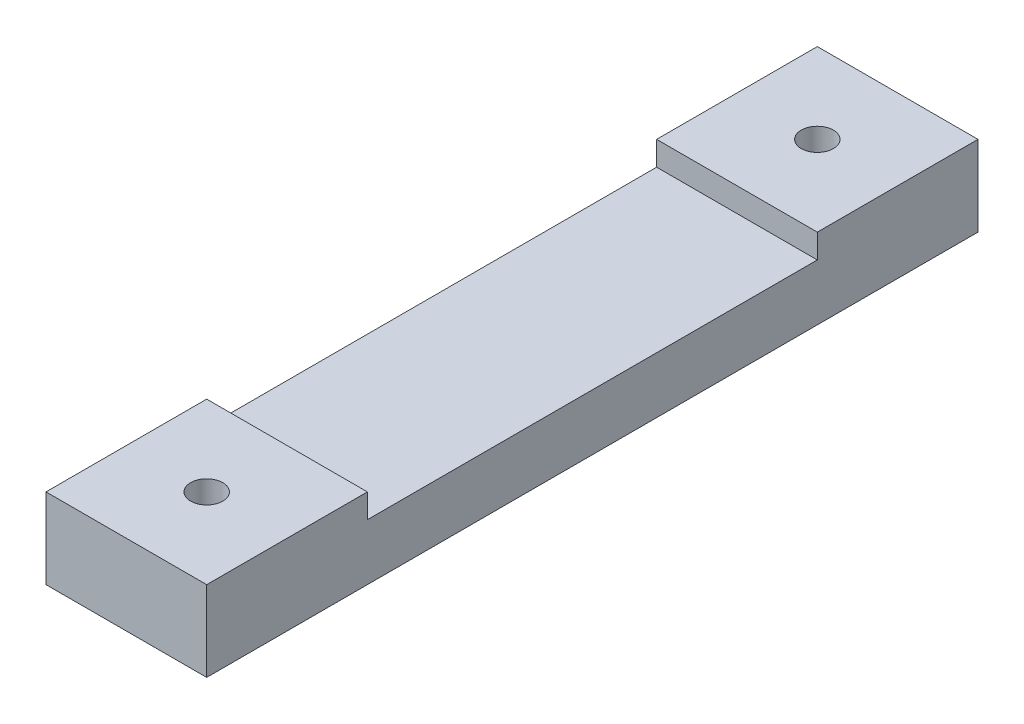
from build123d import *

# Parameters (mm, degrees)
SKETCH1_W           = 10
SKETCH1_H           = 48
BOSS_EXTRUDE1_DEPTH = 3.5
SKETCH2_W           = 10
SKETCH2_H           = 10
BOSS_EXTRUDE2_DEPTH = 1.5
SKETCH3_R           = 1
CUT_EXTRUDE1_DEPTH  = 5


with BuildPart() as part:
    # Sketch1 → Boss-Extrude1 (new body)
    with BuildSketch(Plane(origin=(0, 0, 0), x_dir=(1, 0, 0), z_dir=(0, 1, 0))):
        with Locations((0.145631068, -1.007103337)):
            Rectangle(SKETCH1_W, SKETCH1_H)
    extrude(amount=BOSS_EXTRUDE1_DEPTH)

    # Sketch2 → Boss-Extrude2 (add)
    with BuildSketch(Plane(origin=(0, 3.5, 0), x_dir=(1, 0, 0), z_dir=(0, 1, 0))):
        with Locations((0.145631068, 17.992896663)):
            Rectangle(SKETCH2_W, SKETCH2_H)
        with Locations((0.145631068, -20.007103337)):
            Rectangle(SKETCH2_W, SKETCH2_H)
    extrude(amount=BOSS_EXTRUDE2_DEPTH)

    # Sketch3 → Cut-Extrude1 (cut)
    with BuildSketch(Plane(origin=(0, 5, 0), x_dir=(1, 0, 0), z_dir=(0, 1, 0))):
        with Locations(Location((0.145631068, 17.992896663, 0), (0, 0, 270))):
            Circle(SKETCH3_R)
        with Locations(Location((0.145631068, -20.007103337, 0), (0, 0, 270))):
            Circle(SKETCH3_R)
    extrude(amount=-CUT_EXTRUDE1_DEPTH, mode=Mode.SUBTRACT)


solid = part.part
